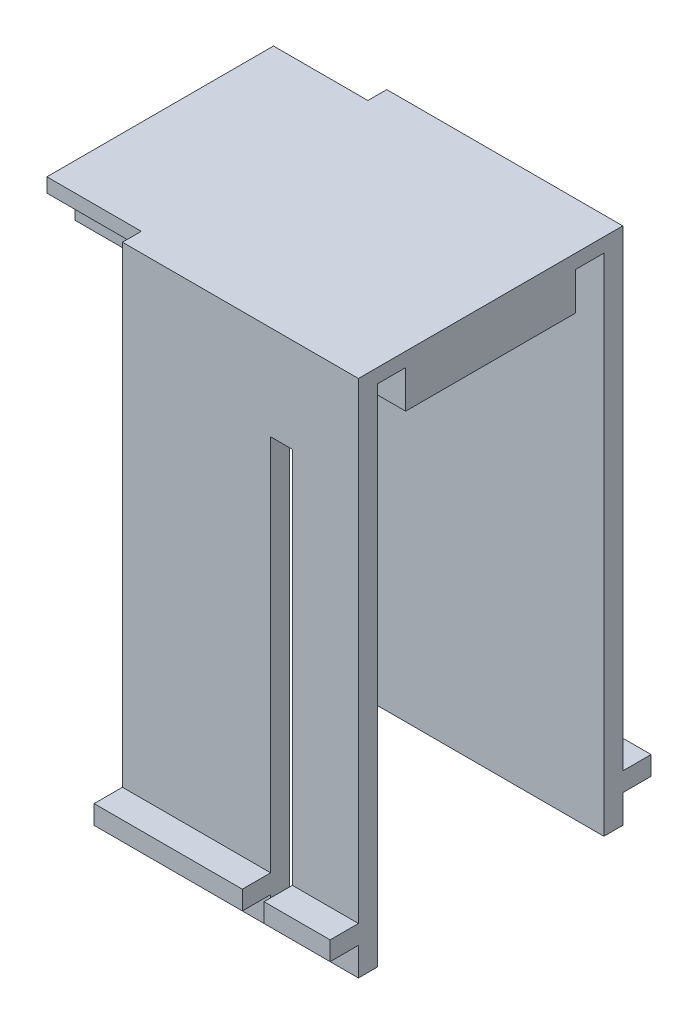
from build123d import *

# Parameters (mm, degrees)
SKETCH1_W           = 25
SKETCH1_H           = 55
BOSS_EXTRUDE1_DEPTH = 2
SKETCH2_W           = 35
SKETCH2_H           = 1.5
BOSS_EXTRUDE2_DEPTH = 24
SKETCH3_W           = 25
SKETCH3_H           = 55
BOSS_EXTRUDE3_DEPTH = 2
SKETCH4_W           = 35
SKETCH4_H           = 18
BOSS_EXTRUDE4_DEPTH = 4
SKETCH5_W           = 2.3
SKETCH5_H           = 45
CUT_EXTRUDE1_DEPTH  = 2
SKETCH6_W           = 15.7
SKETCH6_H           = 2
SKETCH6_W_2         = 7
BOSS_EXTRUDE5_DEPTH = 3
SKETCH7_W           = 25
SKETCH7_H           = 2
BOSS_EXTRUDE6_DEPTH = 3


with BuildPart() as part:
    # Sketch1 → Boss-Extrude1 (new body)
    with BuildSketch(Plane.XY):
        Rectangle(SKETCH1_W, SKETCH1_H)
    extrude(amount=BOSS_EXTRUDE1_DEPTH)

    # Sketch2 → Boss-Extrude2 (add)
    with BuildSketch(Plane(origin=(0, 0, 0), x_dir=(-1, 0, 0), z_dir=(0, 0, -1))):
        with Locations((5, 26.75)):
            Rectangle(SKETCH2_W, SKETCH2_H)
    extrude(amount=BOSS_EXTRUDE2_DEPTH)

    # Sketch3 → Boss-Extrude3 (add)
    with BuildSketch(Plane(origin=(0, 0, -24), x_dir=(-1, 0, 0), z_dir=(0, 0, -1))):
        Rectangle(SKETCH3_W, SKETCH3_H)
    extrude(amount=BOSS_EXTRUDE3_DEPTH)

    # Sketch4 → Boss-Extrude4 (add)
    with BuildSketch(Plane.XZ.offset(-26)):
        with Locations((-5, -12)):
            Rectangle(SKETCH4_W, SKETCH4_H)
    extrude(amount=BOSS_EXTRUDE4_DEPTH)

    # Sketch5 → Cut-Extrude1 (cut)
    with BuildSketch(Plane.XY.offset(2)):
        with Locations((4.35, -5)):
            Rectangle(SKETCH5_W, SKETCH5_H)
    extrude(amount=-CUT_EXTRUDE1_DEPTH, mode=Mode.SUBTRACT)

    # Sketch6 → Boss-Extrude5 (add)
    with BuildSketch(Plane.XY.offset(2)):
        with Locations((-4.65, -23.5)):
            Rectangle(SKETCH6_W, SKETCH6_H)
        with Locations((9, -23.5)):
            Rectangle(SKETCH6_W_2, SKETCH6_H)
    extrude(amount=BOSS_EXTRUDE5_DEPTH)

    # Sketch7 → Boss-Extrude6 (add)
    with BuildSketch(Plane(origin=(0, 0, -26), x_dir=(-1, 0, 0), z_dir=(0, 0, -1))):
        with Locations((0, -23.5)):
            Rectangle(SKETCH7_W, SKETCH7_H)
    extrude(amount=BOSS_EXTRUDE6_DEPTH)


solid = part.part
